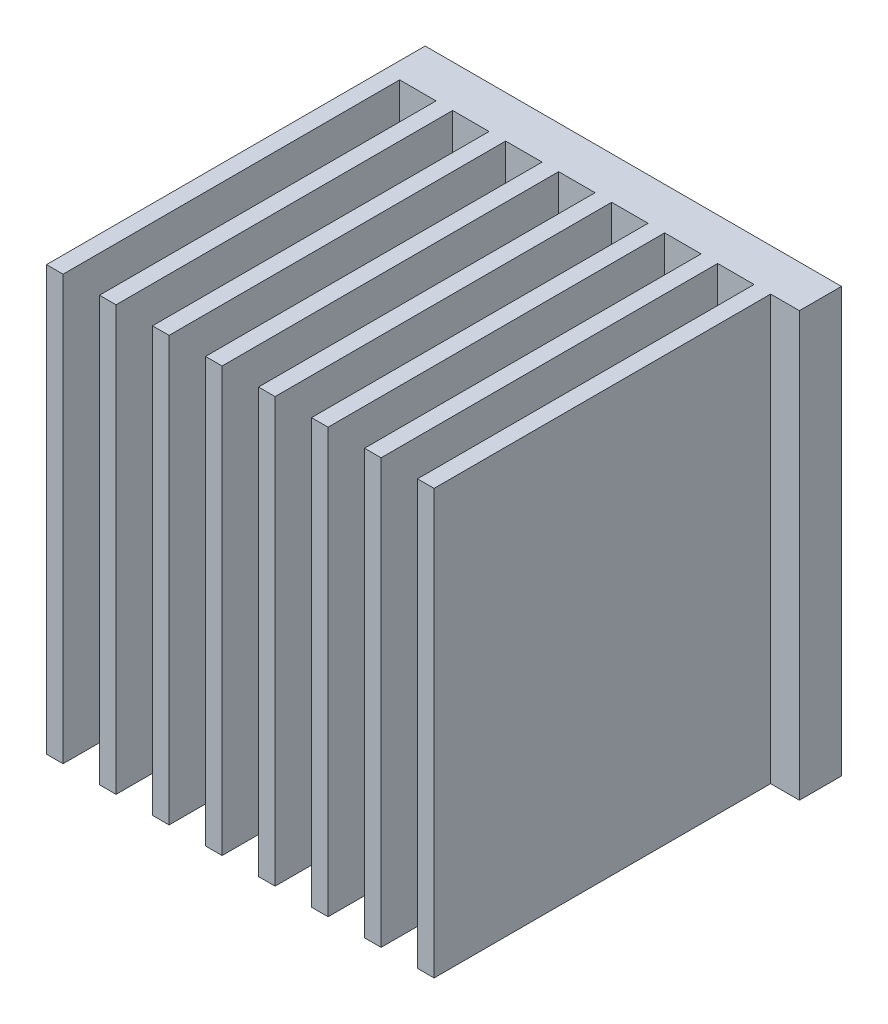
from build123d import *

# Parameters (mm, degrees)
SKETCH1_W           = 31.42
SKETCH1_H           = 32
BOSS_EXTRUDE1_DEPTH = 3.175
SKETCH2_W           = 1.25
SKETCH2_H           = 32
BOSS_EXTRUDE2_DEPTH = 25.4
LPATTERN1_COUNT     = 8
LPATTERN1_PITCH     = 4


with BuildPart() as part:
    # Sketch1 → Boss-Extrude1 (new body)
    with BuildSketch(Plane.XY):
        Rectangle(SKETCH1_W, SKETCH1_H)
    extrude(amount=BOSS_EXTRUDE1_DEPTH)

    # Sketch2 → Boss-Extrude2 (add)
    with BuildSketch(Plane.XY.offset(3.175)):
        with Locations((-15.085, 0)):
            Rectangle(SKETCH2_W, SKETCH2_H)
    boss_extrude2 = extrude(amount=BOSS_EXTRUDE2_DEPTH)

    # LPattern1: Boss-Extrude2 ×8
    with Locations(*[(i * LPATTERN1_PITCH, 0, 0) for i in range(1, LPATTERN1_COUNT)]):
        add(boss_extrude2)


solid = part.part
